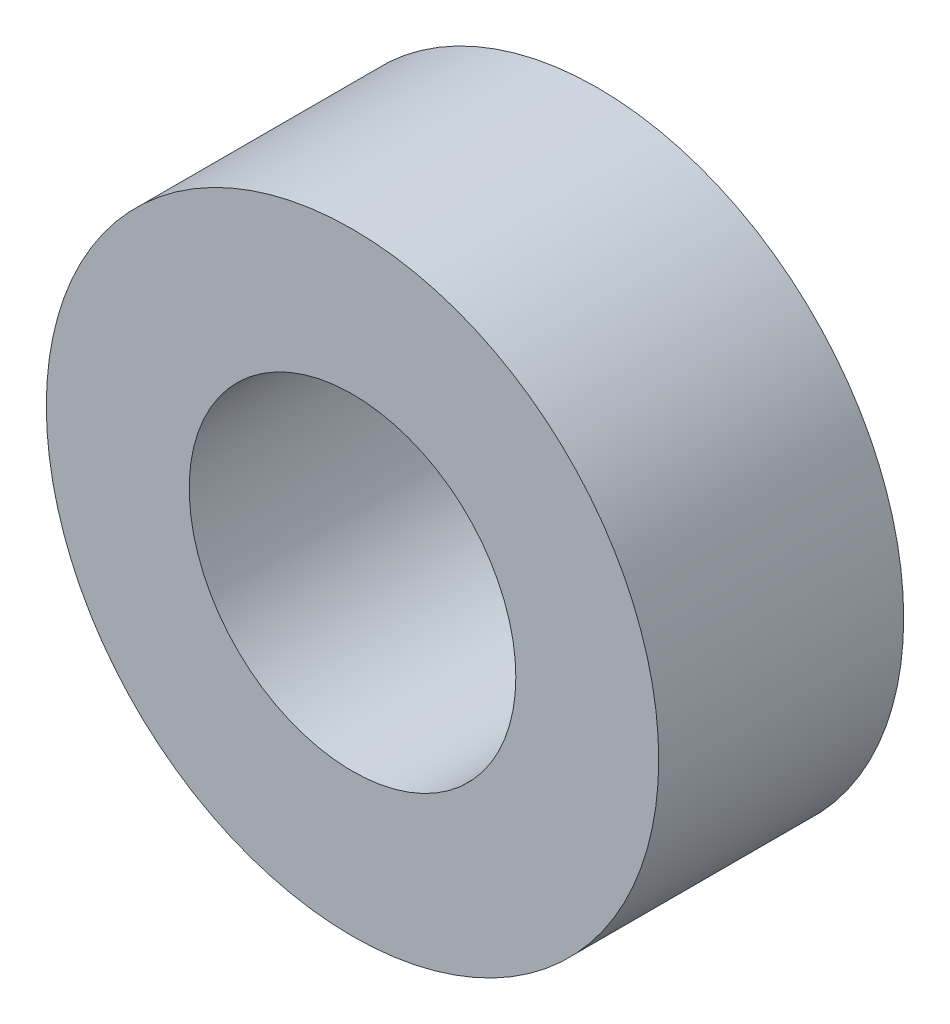
from build123d import *

# Parameters (mm, degrees)
SKETCH_1_R      = 3
SKETCH_1_R_2    = 1.6
EXTRUDE_1_DEPTH = 2.4


with BuildPart() as part:
    # 草圖1 → 填料-伸長1 (new body)
    with BuildSketch(Plane.XY):
        Circle(SKETCH_1_R)
        Circle(SKETCH_1_R_2, mode=Mode.SUBTRACT)
    extrude(amount=EXTRUDE_1_DEPTH)


solid = part.part
